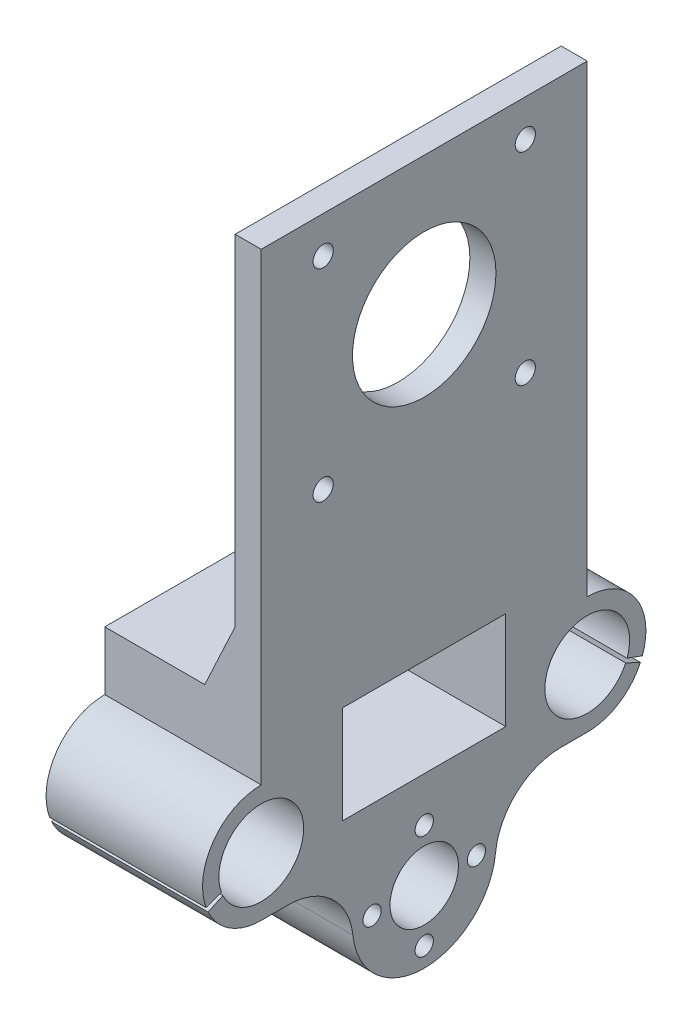
from build123d import *

# Parameters (mm, degrees)
SKETCH1_W           = 50
SKETCH1_H           = 66.15
SKETCH1_R           = 11
SKETCH1_R_2         = 1.55
BOSS_EXTRUDE1_DEPTH = 4
SKETCH2_W           = 50
SKETCH2_H           = 4
BOSS_EXTRUDE2_DEPTH = 38
CHAMFER1_SIZE       = 10
CHAMFER1_SIZE2      = 4.663076582
BOSS_EXTRUDE3_START = -18
SKETCH3_R           = 5.25
SKETCH3_R_2         = 1.4
BOSS_EXTRUDE3_DEPTH = 24
SKETCH4_W           = 18
SKETCH4_H           = 50
CUT_EXTRUDE1_DEPTH  = 24
FILLET1_R           = 10
SKETCH5_W           = 25
SKETCH5_H           = 15
CUT_EXTRUDE2_DEPTH  = 86.707383725


with BuildPart() as part:
    # Sketch1 → Boss-Extrude1 (new body)
    with BuildSketch(Plane(origin=(0, 0, 0), x_dir=(0, 0, -1), z_dir=(1, 0, 0))):
        Rectangle(SKETCH1_W, SKETCH1_H)
        with Locations((0, 11.925)):
            Circle(SKETCH1_R, mode=Mode.SUBTRACT)
        with Locations((-15.5, 27.425)):
            Circle(SKETCH1_R_2, mode=Mode.SUBTRACT)
        with Locations((15.5, 27.425)):
            Circle(SKETCH1_R_2, mode=Mode.SUBTRACT)
        with Locations((15.5, -3.575)):
            Circle(SKETCH1_R_2, mode=Mode.SUBTRACT)
        with Locations((-15.5, -3.575)):
            Circle(SKETCH1_R_2, mode=Mode.SUBTRACT)
    extrude(amount=BOSS_EXTRUDE1_DEPTH)

    # Sketch2 → Boss-Extrude2 (add)
    with BuildSketch(Plane.ZY):
        with Locations((0, -31.075)):
            Rectangle(SKETCH2_W, SKETCH2_H)
    extrude(amount=BOSS_EXTRUDE2_DEPTH)

    # Chamfer1
    chamfer1_edges = [part.edges().sort_by_distance(p)[0] for p in [
        (0, -29.075, 0),
    ]]
    chamfer1_side = [part.faces().sort_by_distance(p)[0] for p in [
        (0, 0.490102601, 0),
    ]]
    chamfer(chamfer1_edges, length=CHAMFER1_SIZE, length2=CHAMFER1_SIZE2, reference=chamfer1_side[0])

    # Sketch3 → Boss-Extrude3 (add)
    with BuildSketch(Plane.ZY.offset(38).offset(BOSS_EXTRUDE3_START)):
        with BuildLine():
            Line((-25, -33.075), (-25, -38.075))
            ThreePointArc((-25, -38.075), (-32.372368399, -41.912812073), (-33.457233587, -50.15318129))
            Line((-33.457233587, -50.15318129), (-31.108002035, -49.298130932))
            ThreePointArc((-31.108002035, -49.298130932), (-18.994783039, -44.58755769), (-30.891000616, -49.822018701))
            Line((-30.891000616, -49.822018701), (-33.156770083, -50.878564356))
            ThreePointArc((-33.156770083, -50.878564356), (-29.835696475, -54.665523012), (-25, -56.075))
            Line((-25, -56.075), (-7.705679723, -56.075))
            ThreePointArc((-7.705679723, -56.075), (0, -74.925), (7.705679723, -56.075))
            Line((7.705679723, -56.075), (25, -56.075))
            ThreePointArc((25, -56.075), (29.835696475, -54.665523012), (33.156770083, -50.878564356))
            Line((33.156770083, -50.878564356), (30.891000616, -49.822018701))
            ThreePointArc((30.891000616, -49.822018701), (18.994783039, -44.58755769), (31.108002035, -49.298130932))
            Line((31.108002035, -49.298130932), (33.457233587, -50.15318129))
            ThreePointArc((33.457233587, -50.15318129), (32.372368399, -41.912812073), (25, -38.075))
            Line((25, -38.075), (25, -33.075))
            Line((25, -33.075), (-25, -33.075))
        make_face()
        with Locations((0, -63.925)):
            Circle(SKETCH3_R, mode=Mode.SUBTRACT)
        with Locations((0, -55.925)):
            Circle(SKETCH3_R_2, mode=Mode.SUBTRACT)
        with Locations((-8, -63.925)):
            Circle(SKETCH3_R_2, mode=Mode.SUBTRACT)
        with Locations((0, -71.925)):
            Circle(SKETCH3_R_2, mode=Mode.SUBTRACT)
        with Locations((8, -63.925)):
            Circle(SKETCH3_R_2, mode=Mode.SUBTRACT)
    extrude(amount=-BOSS_EXTRUDE3_DEPTH)

    # Sketch4 → Cut-Extrude1 (cut)
    with BuildSketch(Plane.XZ.offset(33.075)):
        with Locations((-29, 0)):
            Rectangle(SKETCH4_W, SKETCH4_H)
    extrude(amount=-CUT_EXTRUDE1_DEPTH, mode=Mode.SUBTRACT)

    # Fillet1
    fillet1_edges = [part.edges().sort_by_distance(p)[0] for p in [
        (-8, -56.075, -7.705679723),
        (-8, -56.075, 7.705679723),
    ]]
    fillet(fillet1_edges, radius=FILLET1_R)

    # Sketch5 → Cut-Extrude2 (cut, through all)
    with BuildSketch(Plane.ZY.offset(20)):
        with Locations((0, -41.575)):
            Rectangle(SKETCH5_W, SKETCH5_H)
    extrude(amount=-CUT_EXTRUDE2_DEPTH, mode=Mode.SUBTRACT)


solid = part.part
